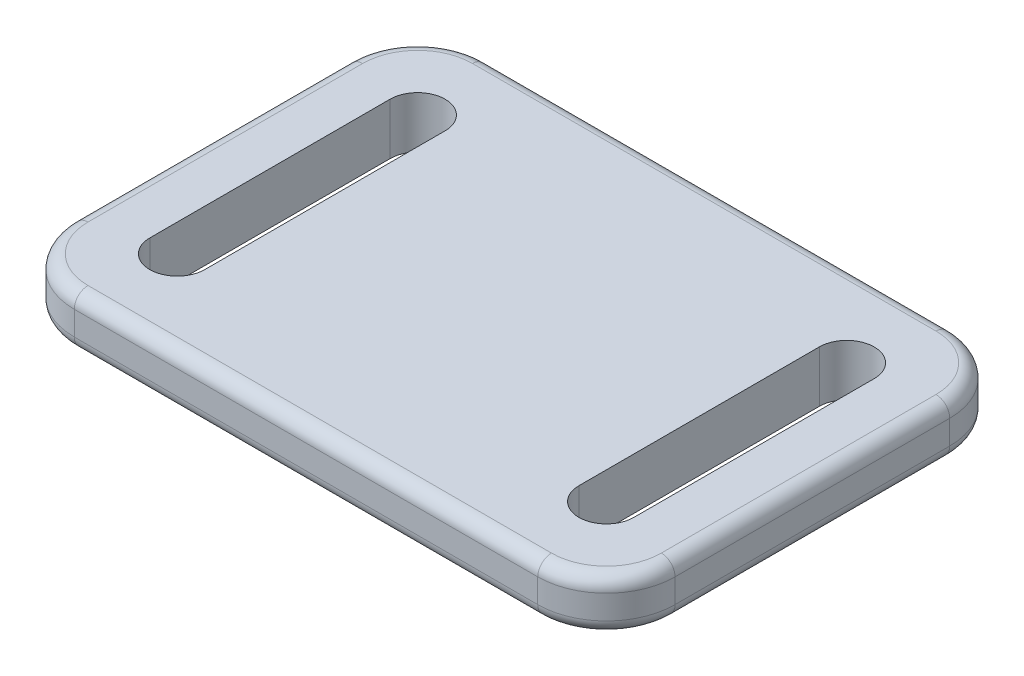
from build123d import *

# Parameters (mm, degrees)
SKETCH1_W           = 35
SKETCH1_H           = 24
BOSS_EXTRUDE1_DEPTH = 3
CUT_EXTRUDE1_DEPTH  = 7
FILLET1_R           = 4
FILLET2_R           = 0.8


with BuildPart() as part:
    # Sketch1 → Boss-Extrude1 (new body)
    with BuildSketch(Plane(origin=(0, 0, 0), x_dir=(1, 0, 0), z_dir=(0, 1, 0))):
        with Locations((17.5, 12)):
            Rectangle(SKETCH1_W, SKETCH1_H)
    extrude(amount=BOSS_EXTRUDE1_DEPTH)

    # Sketch2 → Cut-Extrude1 (cut)
    with BuildSketch(Plane(origin=(0, 3, 0), x_dir=(1, 0, 0), z_dir=(0, 1, 0))):
        with BuildLine():
            Line((6.6, 19), (6.6, 5))
            ThreePointArc((6.6, 5), (5, 3.4), (3.4, 5))
            Line((3.4, 5), (3.4, 19))
            ThreePointArc((3.4, 19), (5, 20.6), (6.6, 19))
        make_face()
        with BuildLine():
            Line((28.4, 19), (28.4, 5))
            ThreePointArc((28.4, 5), (30, 3.4), (31.6, 5))
            Line((31.6, 5), (31.6, 19))
            ThreePointArc((31.6, 19), (30, 20.6), (28.4, 19))
        make_face()
    extrude(amount=-CUT_EXTRUDE1_DEPTH, mode=Mode.SUBTRACT)

    # Fillet1
    fillet1_edges = [part.edges().sort_by_distance(p)[0] for p in [
        (0, 1.5, 0),
        (0, 1.5, -24),
        (35, 1.5, -24),
        (35, 1.5, 0),
    ]]
    fillet(fillet1_edges, radius=FILLET1_R)

    # Fillet2
    fillet2_edges = [part.edges().sort_by_distance(p)[0] for p in [
        (0, 0, -12),
        (0, 3, -12),
        (17.5, 0, 0),
        (17.5, 0, -24),
        (35, 0, -12),
        (33.828427125, 0, -22.828427125),
        (33.828427125, 0, -1.171572875),
        (1.171572875, 0, -1.171572875),
        (1.171572875, 0, -22.828427125),
        (17.5, 3, -24),
        (17.5, 3, 0),
        (35, 3, -12),
        (33.828427125, 3, -22.828427125),
        (33.828427125, 3, -1.171572875),
        (1.171572875, 3, -1.171572875),
        (1.171572875, 3, -22.828427125),
    ]]
    fillet(fillet2_edges, radius=FILLET2_R)


solid = part.part
